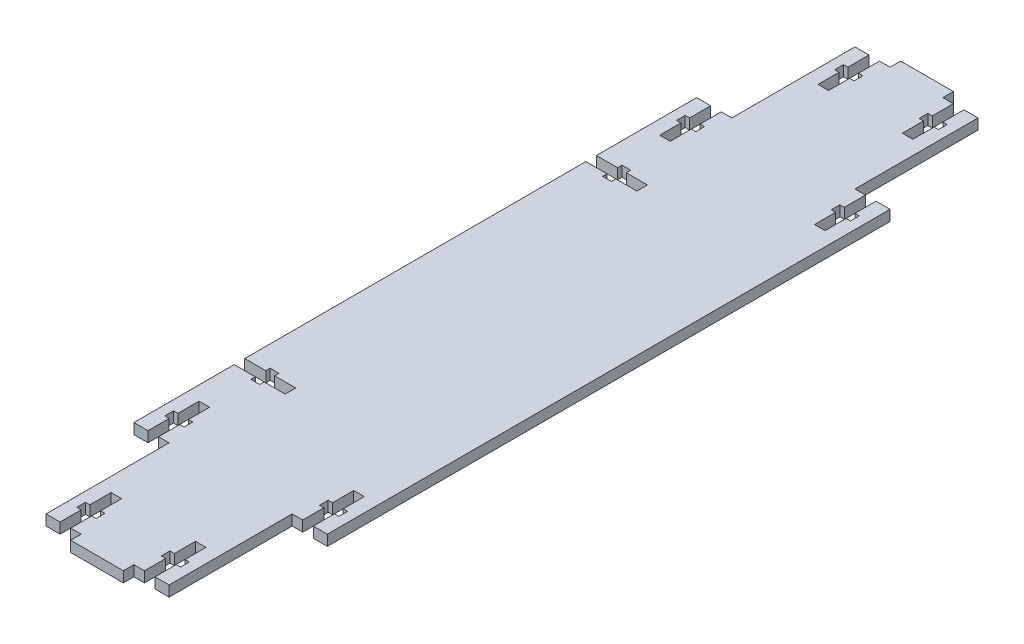
from build123d import *

# Parameters (mm, degrees)
SKETCH_1_W           = 55
SKETCH_1_H           = 160
EXTRUDE_1_DEPTH      = 3
EXTRUDE_2_DEPTH      = 35
EXTRUDE_2_DEPTH_BACK = 195
SKETCH_2_W           = 35
SKETCH_2_H           = 3
EXTRUDE_3_DEPTH      = 3
EXTRUDE_3_DEPTH_BACK = 233
SKETCH_3_W           = 15
SKETCH_3_H           = 3
CUT_EXTRUDE_1_DEPTH  = 3
CUT_EXTRUDE_2_DEPTH  = 3


with BuildPart() as part:
    # Эскиз1 → Бобышка-Вытянуть1 (new body)
    with BuildSketch(Plane(origin=(0, 0, 0), x_dir=(1, 0, 0), z_dir=(0, 1, 0))):
        Rectangle(SKETCH_1_W, SKETCH_1_H)
    extrude(amount=EXTRUDE_1_DEPTH)

    # Эскиз2 → Бобышка-Вытянуть2 (add, two sides: drawn at the far end of the back side and taken through both)
    with BuildSketch(Plane(origin=(0, 0, -80), x_dir=(-1, 0, 0), z_dir=(0, 0, -1)).offset(-EXTRUDE_2_DEPTH_BACK)):
        with Locations((0, 1.5)):
            Rectangle(SKETCH_2_W, SKETCH_2_H)
    extrude(amount=EXTRUDE_2_DEPTH + EXTRUDE_2_DEPTH_BACK)

    # Эскиз3 → Бобышка-Вытянуть3 (add, two sides: drawn at the far end of the back side and taken through both)
    with BuildSketch(Plane(origin=(0, 0, -115), x_dir=(-1, 0, 0), z_dir=(0, 0, -1)).offset(-EXTRUDE_3_DEPTH_BACK)):
        with Locations((0, 1.5)):
            Rectangle(SKETCH_3_W, SKETCH_3_H)
    extrude(amount=EXTRUDE_3_DEPTH + EXTRUDE_3_DEPTH_BACK)

    # Эскиз4 → Вырез-Вытянуть1 (cut)
    with BuildSketch(Plane(origin=(0, 3, 0), x_dir=(1, 0, 0), z_dir=(0, 1, 0))):
        Polygon((-23.5, 80), (-23.5, 74), (-24.75, 74), (-24.75, 71.5), (-23.5, 71.5), (-23.5, 65.5), (-20.5, 65.5), (-20.5, 71.5), (-19.25, 71.5), (-19.25, 74), (-20.5, 74), (-20.5, 80), align=None)
        Polygon((-13.5, 115), (-13.5, 109), (-14.75, 109), (-14.75, 106.5), (-13.5, 106.5), (-13.5, 100.5), (-10.5, 100.5), (-10.5, 106.5), (-9.25, 106.5), (-9.25, 109), (-10.5, 109), (-10.5, 115), align=None)
        Polygon((10.5, 115), (13.5, 115), (13.5, 109), (14.75, 109), (14.75, 106.5), (13.5, 106.5), (13.5, 100.5), (10.5, 100.5), (10.5, 106.5), (9.25, 106.5), (9.25, 109), (10.5, 109), align=None)
        Polygon((20.5, 80), (23.5, 80), (23.5, 74), (24.75, 74), (24.75, 71.5), (23.5, 71.5), (23.5, 65.5), (20.5, 65.5), (20.5, 71.5), (19.25, 71.5), (19.25, 74), (20.5, 74), align=None)
        Polygon((-10.5, -115), (-13.5, -115), (-13.5, -109), (-14.75, -109), (-14.75, -106.5), (-13.5, -106.5), (-13.5, -100.5), (-10.5, -100.5), (-10.5, -106.5), (-9.25, -106.5), (-9.25, -109), (-10.5, -109), align=None)
        Polygon((13.5, -115), (13.5, -109), (14.75, -109), (14.75, -106.5), (13.5, -106.5), (13.5, -100.5), (10.5, -100.5), (10.5, -106.5), (9.25, -106.5), (9.25, -109), (10.5, -109), (10.5, -115), align=None)
        Polygon((-20.5, -80), (-23.5, -80), (-23.5, -74), (-24.75, -74), (-24.75, -71.5), (-23.5, -71.5), (-23.5, -65.5), (-20.5, -65.5), (-20.5, -71.5), (-19.25, -71.5), (-19.25, -74), (-20.5, -74), align=None)
        Polygon((23.5, -80), (23.5, -74), (24.75, -74), (24.75, -71.5), (23.5, -71.5), (23.5, -65.5), (20.5, -65.5), (20.5, -71.5), (19.25, -71.5), (19.25, -74), (20.5, -74), (20.5, -80), align=None)
    extrude(amount=-CUT_EXTRUDE_1_DEPTH, mode=Mode.SUBTRACT)

    # Эскиз5 → Вырез-Вытянуть2 (cut)
    with BuildSketch(Plane(origin=(0, 3, 0), x_dir=(1, 0, 0), z_dir=(0, 1, 0))):
        Polygon((-27.5, 51.5), (-21.5, 51.5), (-21.5, 52.75), (-19, 52.75), (-19, 51.5), (-13, 51.5), (-13, 48.5), (-19, 48.5), (-19, 47.25), (-21.5, 47.25), (-21.5, 48.5), (-27.5, 48.5), align=None)
        Polygon((-27.5, -48.5), (-27.5, -51.5), (-21.5, -51.5), (-21.5, -52.75), (-19, -52.75), (-19, -51.5), (-13, -51.5), (-13, -48.5), (-19, -48.5), (-19, -47.25), (-21.5, -47.25), (-21.5, -48.5), align=None)
    extrude(amount=-CUT_EXTRUDE_2_DEPTH, mode=Mode.SUBTRACT)


solid = part.part
